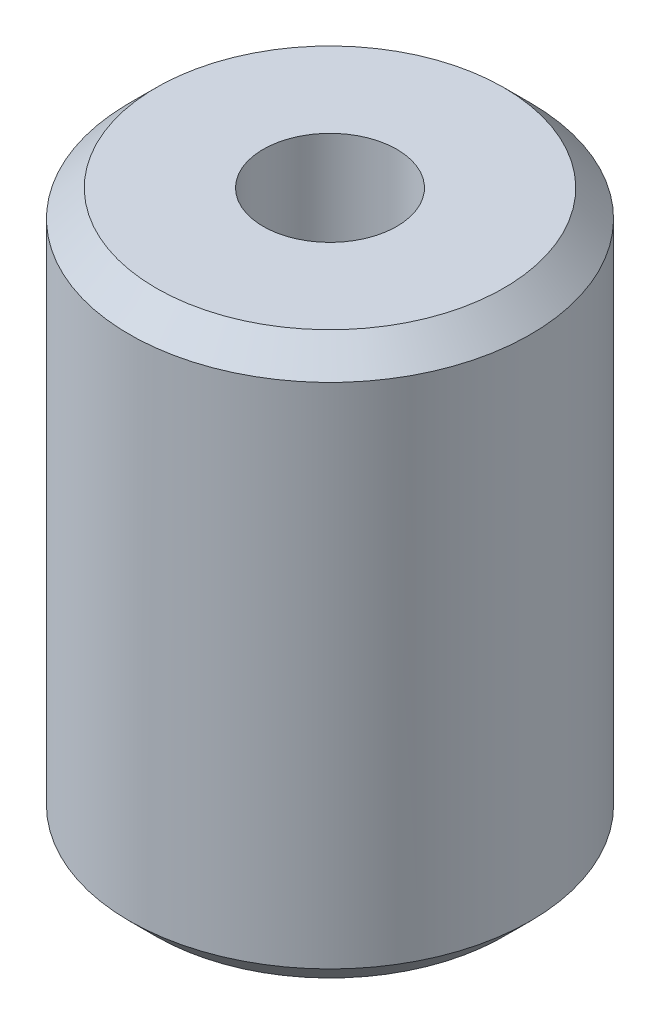
from build123d import *

# Parameters (mm, degrees)
SKETCH_1_R      = 7.5
SKETCH_1_R_2    = 2.5
EXTRUDE_1_DEPTH = 10.5
CHAMFER_1_SIZE  = 1


with BuildPart() as part:
    # Эскиз1 → Бобышка-Вытянуть1 (new, symmetric)
    with BuildSketch(Plane(origin=(0, 0, 0), x_dir=(1, 0, 0), z_dir=(0, 1, 0))):
        with Locations(Location((0, 0, 0), (0, 0, 90))):
            Circle(SKETCH_1_R)
        with Locations(Location((0, 0, 0), (0, 0, 90))):
            Circle(SKETCH_1_R_2, mode=Mode.SUBTRACT)
    extrude(amount=EXTRUDE_1_DEPTH, both=True)

    # Фаска1
    chamfer_1_edges = [part.edges().sort_by_distance(p)[0] for p in [
        (0, -10.5, 7.5),
        (0, 10.5, 7.5),
    ]]
    chamfer(chamfer_1_edges, length=CHAMFER_1_SIZE)


solid = part.part
